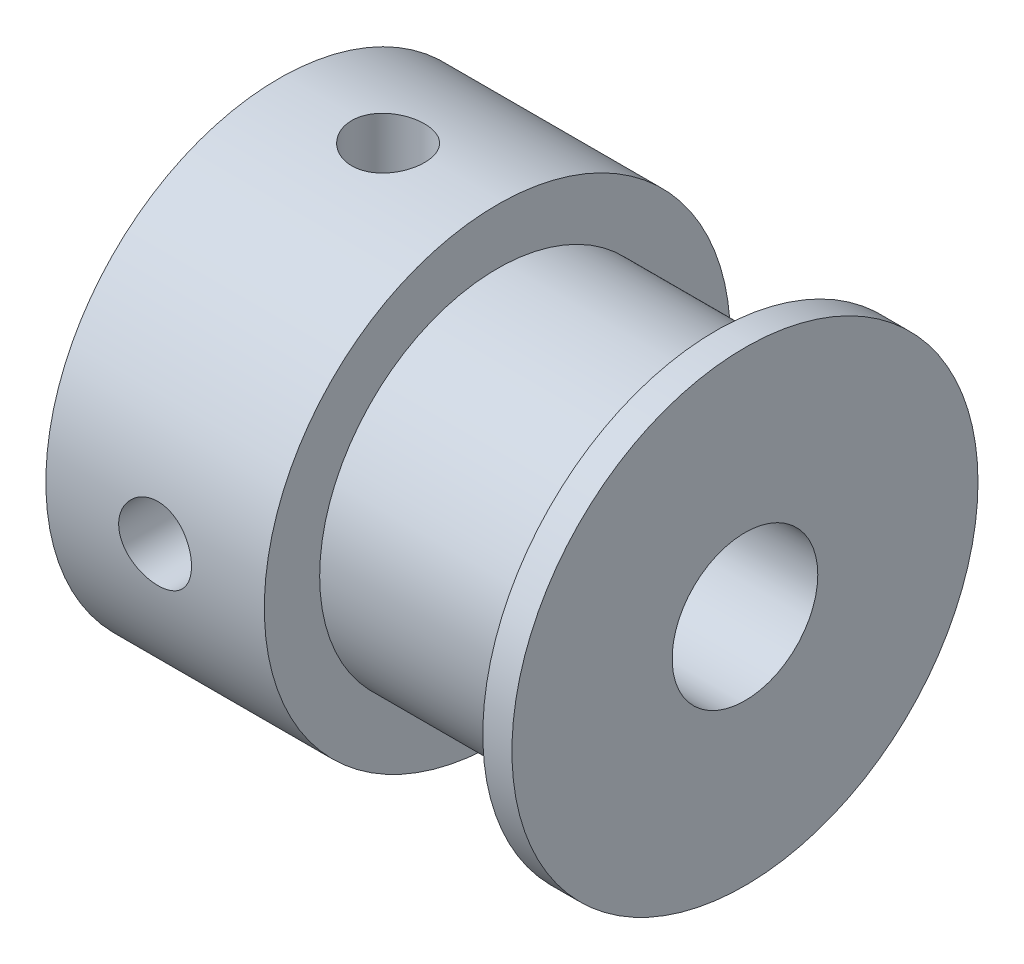
from build123d import *

# Parameters (mm, degrees)
SKETCH2_W = 1.25
SKETCH2_H = 8
SKETCH4_W = 1.25
SKETCH4_H = 8


with BuildPart() as part:
    # Sketch1 → Revolve1 (revolve)
    with BuildSketch(Plane.XY, mode=Mode.PRIVATE) as revolve1_sk:
        Polygon((0, 2.5), (0, 8), (7.5, 8), (7.5, 6.1), (15, 6.1), (15, 8), (16, 8), (16, 2.5), align=None)
    revolve(revolve1_sk.sketch.rotate(Axis((0, 0, 0), (-1, 0, 0)), 90), axis=Axis((0, 0, 0), (-1, 0, 0)))

    # Sketch2 → M3x0.5 Tapped Hole1 (revolve, cut)
    with BuildSketch(Plane(origin=(3.75, 0, 0), x_dir=(0, 0, -1), z_dir=(1, 0, 0))):
        with Locations((0.625, 4)):
            Rectangle(SKETCH2_W, SKETCH2_H)
    revolve(axis=Axis((3.75, -6.35, 0), (0, 1, 0)), mode=Mode.SUBTRACT)

    # Sketch4 → M3x0.5 Tapped Hole2 (revolve, cut)
    with BuildSketch(Plane.YZ.offset(3.75)):
        with Locations((0.625, 4)):
            Rectangle(SKETCH4_W, SKETCH4_H)
    revolve(axis=Axis((3.75, 0, -6.35), (0, 0, 1)), mode=Mode.SUBTRACT)


solid = part.part
